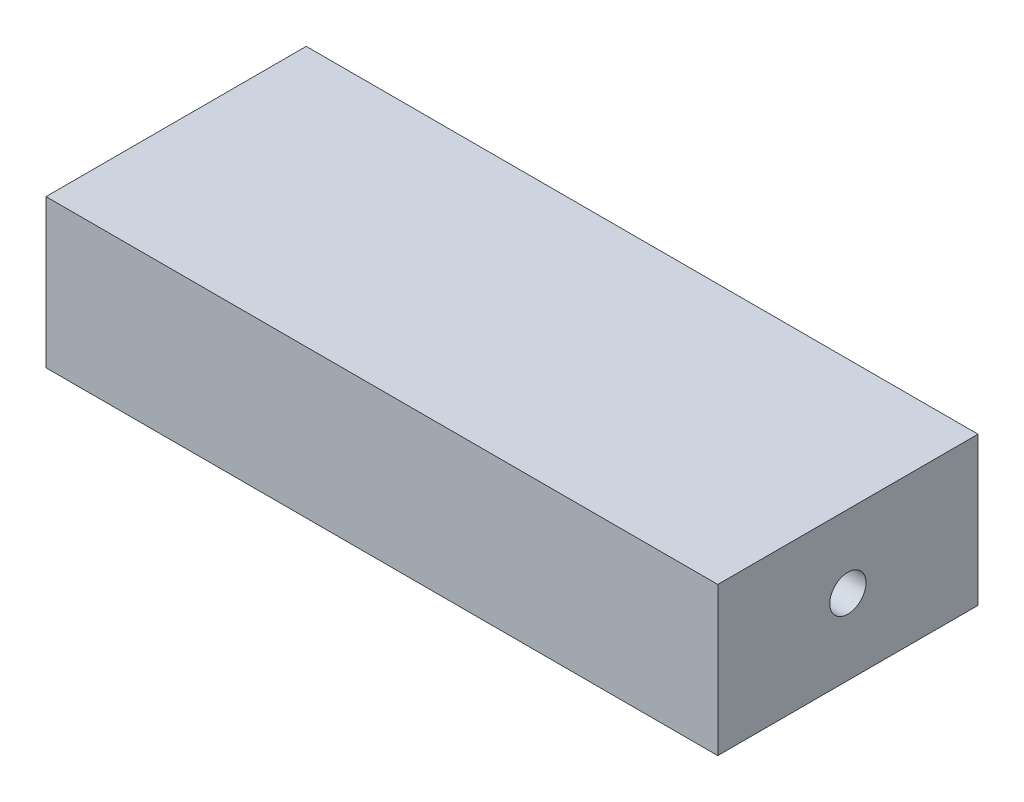
from build123d import *

# Parameters (mm, degrees)
SKETCH1_W           = 222
SKETCH1_H           = 86
BOSS_EXTRUDE1_DEPTH = 22
SKETCH2_R           = 6
CUT_EXTRUDE1_DEPTH  = 30
SKETCH3_W           = 222
SKETCH3_H           = 86
BOSS_EXTRUDE2_DEPTH = 14
SKETCH4_W           = 222
SKETCH4_H           = 86
BOSS_EXTRUDE3_DEPTH = 13


with BuildPart() as part:
    # Sketch1 → Boss-Extrude1 (new body)
    with BuildSketch(Plane(origin=(0, 0, 0), x_dir=(1, 0, 0), z_dir=(0, 1, 0))):
        Rectangle(SKETCH1_W, SKETCH1_H)
    extrude(amount=BOSS_EXTRUDE1_DEPTH)

    # Sketch2 → Cut-Extrude1 (cut)
    with BuildSketch(Plane(origin=(111, 0, 0), x_dir=(0, 0, -1), z_dir=(1, 0, 0))):
        with Locations((0, 11)):
            Circle(SKETCH2_R)
    extrude(amount=-CUT_EXTRUDE1_DEPTH, mode=Mode.SUBTRACT)

    # Sketch3 → Boss-Extrude2 (add)
    with BuildSketch(Plane.XZ):
        Rectangle(SKETCH3_W, SKETCH3_H)
    extrude(amount=BOSS_EXTRUDE2_DEPTH)

    # Sketch4 → Boss-Extrude3 (add)
    with BuildSketch(Plane(origin=(0, 22, 0), x_dir=(1, 0, 0), z_dir=(0, 1, 0))):
        Rectangle(SKETCH4_W, SKETCH4_H)
    extrude(amount=BOSS_EXTRUDE3_DEPTH)


solid = part.part
